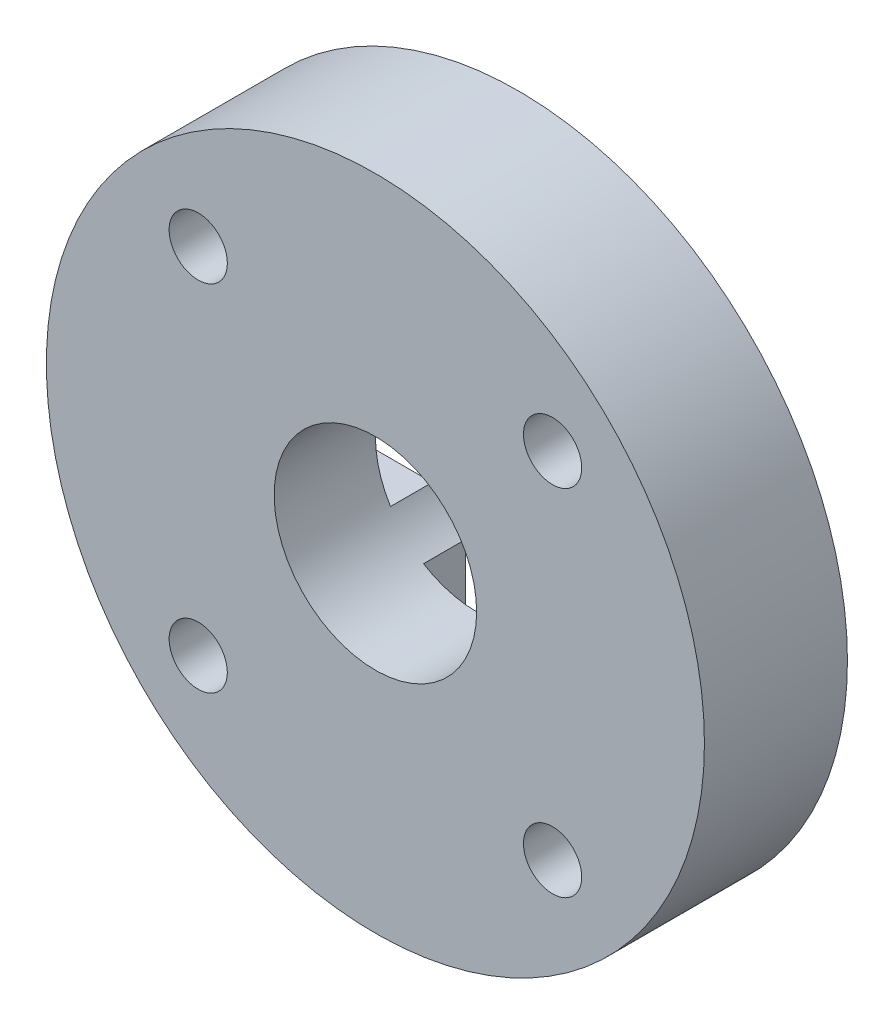
from build123d import *

# Parameters (mm, degrees)
TRIAL_LOAD_PLATE_PROFILE_R           = 13
TRIAL_LOAD_PLATE_PROFILE_R_2         = 4
TRIAL_LOAD_PLATE_DEPTH               = 4
CAPTURED_HORN_KEY_BOSS_START         = -1.65
CAPTURED_HORN_KEY_BOSS_PROFILE_R     = 13
CAPTURED_HORN_KEY_BOSS_DEPTH         = 1.65
KEY_POCKET_HUB_START                 = -1.65
STOCK_HORN_POCKET_HUB_R              = 3.55
KEY_POCKET_HUB_DEPTH                 = 1.65
KEY_POCKET_HORIZONTAL_START          = -1.65
STOCK_HORN_POCKET_HORIZONTAL_W       = 16.3
STOCK_HORN_POCKET_HORIZONTAL_H       = 4.2
KEY_POCKET_HORIZONTAL_DEPTH          = 1.65
KEY_POCKET_VERTICAL_START            = -1.65
STOCK_HORN_POCKET_VERTICAL_W         = 4.2
STOCK_HORN_POCKET_VERTICAL_H         = 16.3
KEY_POCKET_VERTICAL_DEPTH            = 1.65
KEY_POCKET_ROUNDED_TIPS_START        = -1.65
STOCK_HORN_POCKET_ROUNDED_TIPS_R     = 2.1
KEY_POCKET_ROUNDED_TIPS_DEPTH        = 1.65
UNMODIFIED_HORN_CAPTURE_M2_START     = -50
UNMODIFIED_HORN_CAPTURE_M2_PROFILE_R = 1.15
UNMODIFIED_HORN_CAPTURE_M2_DEPTH     = 69.814887722
HUB_CLEARANCE_IN_KEY_BOSS_ONLY_START = -1.65
HORN_CENTER_HUB_CLEARANCE_R          = 4
HUB_CLEARANCE_IN_KEY_BOSS_ONLY_DEPTH = 1.65


with BuildPart() as part:
    # Trial_load_plate_profile → Trial_load_plate (new body)
    with BuildSketch(Plane.XY):
        Circle(TRIAL_LOAD_PLATE_PROFILE_R)
        Circle(TRIAL_LOAD_PLATE_PROFILE_R_2, mode=Mode.SUBTRACT)
    extrude(amount=TRIAL_LOAD_PLATE_DEPTH)

    # Captured_horn_key_boss_profile → Captured_horn_key_boss (add)
    with BuildSketch(Plane.XY.offset(CAPTURED_HORN_KEY_BOSS_START)):
        Circle(CAPTURED_HORN_KEY_BOSS_PROFILE_R)
    extrude(amount=CAPTURED_HORN_KEY_BOSS_DEPTH)

    # Stock_horn_pocket_Hub → Key_pocket_Hub (cut)
    with BuildSketch(Plane.XY.offset(KEY_POCKET_HUB_START)):
        Circle(STOCK_HORN_POCKET_HUB_R)
    extrude(amount=KEY_POCKET_HUB_DEPTH, mode=Mode.SUBTRACT)

    # Stock_horn_pocket_Horizontal → Key_pocket_Horizontal (cut)
    with BuildSketch(Plane.XY.offset(KEY_POCKET_HORIZONTAL_START)):
        Rectangle(STOCK_HORN_POCKET_HORIZONTAL_W, STOCK_HORN_POCKET_HORIZONTAL_H)
    extrude(amount=KEY_POCKET_HORIZONTAL_DEPTH, mode=Mode.SUBTRACT)

    # Stock_horn_pocket_Vertical → Key_pocket_Vertical (cut)
    with BuildSketch(Plane.XY.offset(KEY_POCKET_VERTICAL_START)):
        Rectangle(STOCK_HORN_POCKET_VERTICAL_W, STOCK_HORN_POCKET_VERTICAL_H)
    extrude(amount=KEY_POCKET_VERTICAL_DEPTH, mode=Mode.SUBTRACT)

    # Stock_horn_pocket_Rounded_tips → Key_pocket_Rounded_tips (cut)
    with BuildSketch(Plane.XY.offset(KEY_POCKET_ROUNDED_TIPS_START)):
        with Locations((8.15, 0)):
            Circle(STOCK_HORN_POCKET_ROUNDED_TIPS_R)
        with Locations((-8.15, 0)):
            Circle(STOCK_HORN_POCKET_ROUNDED_TIPS_R)
        with Locations((0, 8.15)):
            Circle(STOCK_HORN_POCKET_ROUNDED_TIPS_R)
        with Locations((0, -8.15)):
            Circle(STOCK_HORN_POCKET_ROUNDED_TIPS_R)
    extrude(amount=KEY_POCKET_ROUNDED_TIPS_DEPTH, mode=Mode.SUBTRACT)

    # Unmodified_horn_capture_M2_profile → Unmodified_horn_capture_M2 (cut, through all)
    with BuildSketch(Plane.XY.offset(UNMODIFIED_HORN_CAPTURE_M2_START)):
        with Locations((7, 7)):
            Circle(UNMODIFIED_HORN_CAPTURE_M2_PROFILE_R)
        with Locations((-7, 7)):
            Circle(UNMODIFIED_HORN_CAPTURE_M2_PROFILE_R)
        with Locations((-7, -7)):
            Circle(UNMODIFIED_HORN_CAPTURE_M2_PROFILE_R)
        with Locations((7, -7)):
            Circle(UNMODIFIED_HORN_CAPTURE_M2_PROFILE_R)
    extrude(amount=UNMODIFIED_HORN_CAPTURE_M2_DEPTH, mode=Mode.SUBTRACT)

    # Horn_center_hub_clearance → Hub_clearance_in_key_boss_only (cut)
    with BuildSketch(Plane.XY.offset(HUB_CLEARANCE_IN_KEY_BOSS_ONLY_START)):
        with Locations(Location((0, 0, 0), (0, 0, 148.331756746))):
            Circle(HORN_CENTER_HUB_CLEARANCE_R)
    extrude(amount=HUB_CLEARANCE_IN_KEY_BOSS_ONLY_DEPTH, mode=Mode.SUBTRACT)


solid = part.part
